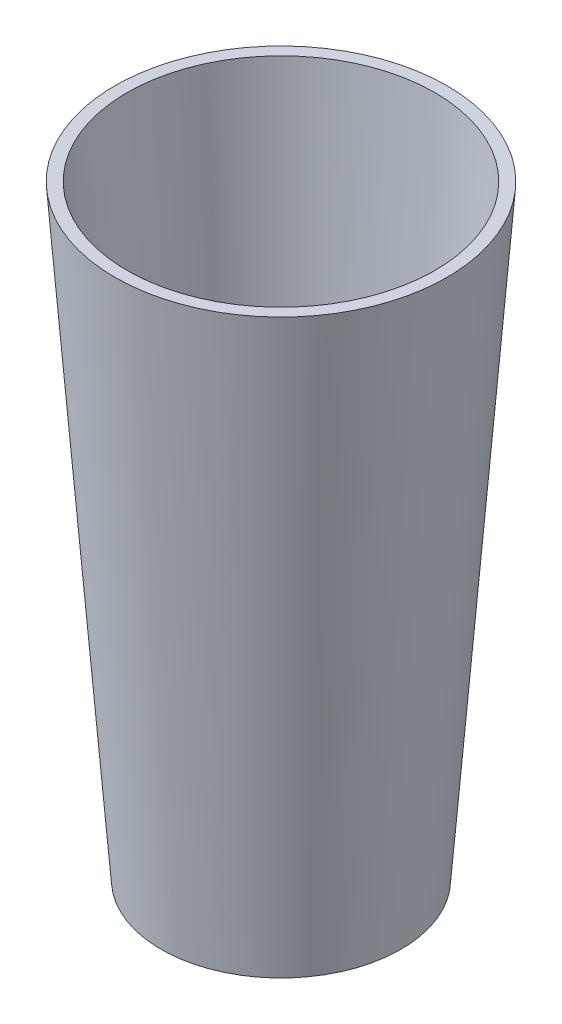
from build123d import *


with BuildPart() as part:
    # Sketch1 → Revolve1 (revolve)
    with BuildSketch(Plane.XY, mode=Mode.PRIVATE) as revolve1_sk:
        Polygon((-41.529, 151.333), (-30, 0), (0, 0), (0, 4), (-27.296038773, 4), (-38.520306824, 151.333), align=None)
    revolve(revolve1_sk.sketch.rotate(Axis((0, 0, 0), (0, 1, 0)), 270), axis=Axis((0, 0, 0), (0, 1, 0)))


solid = part.part
